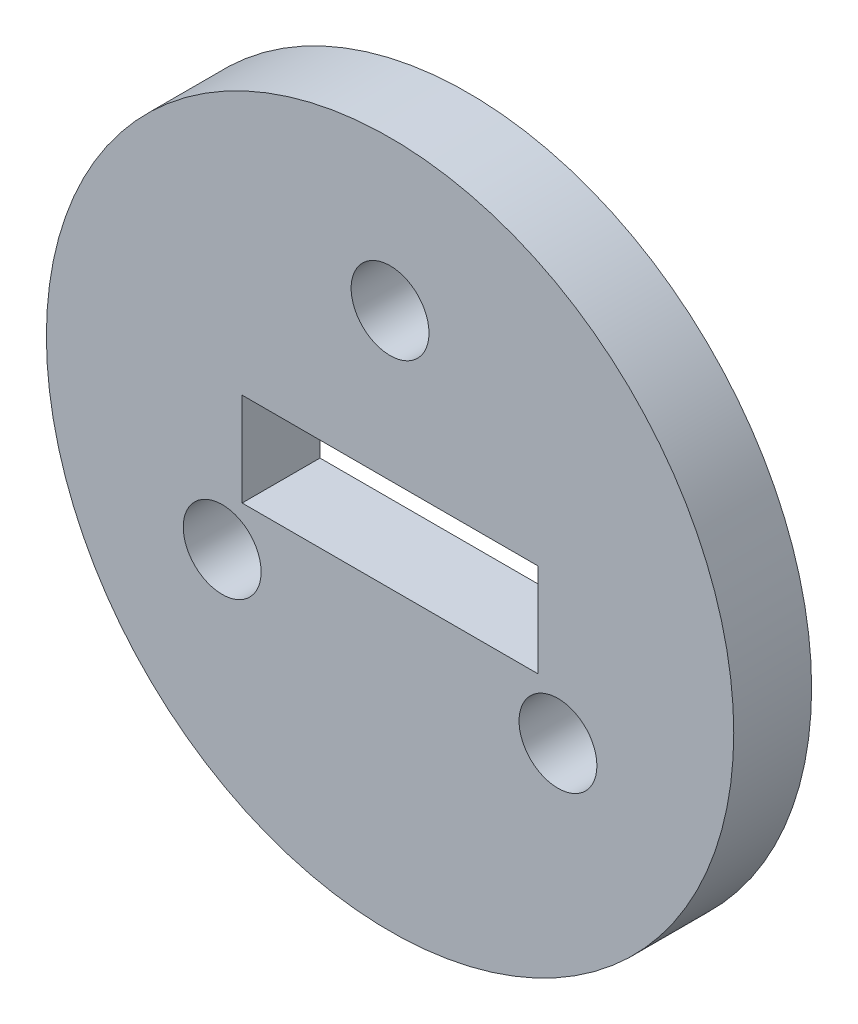
from build123d import *

# Parameters (mm, degrees)
SKETCH_1_R      = 22.071639064
SKETCH_1_R_2    = 2.5
SKETCH_1_W      = 19
SKETCH_1_H      = 6
EXTRUDE_1_DEPTH = 5


with BuildPart() as part:
    # 스케치1 → 보스-돌출1 (new body)
    with BuildSketch(Plane.XY):
        Circle(SKETCH_1_R)
        with Locations((0, 12.45)):
            Circle(SKETCH_1_R_2, mode=Mode.SUBTRACT)
        with Locations((10.782016277, -6.225)):
            Circle(SKETCH_1_R_2, mode=Mode.SUBTRACT)
        with Locations((-10.782016277, -6.225)):
            Circle(SKETCH_1_R_2, mode=Mode.SUBTRACT)
        Rectangle(SKETCH_1_W, SKETCH_1_H, mode=Mode.SUBTRACT)
    extrude(amount=EXTRUDE_1_DEPTH)


solid = part.part
